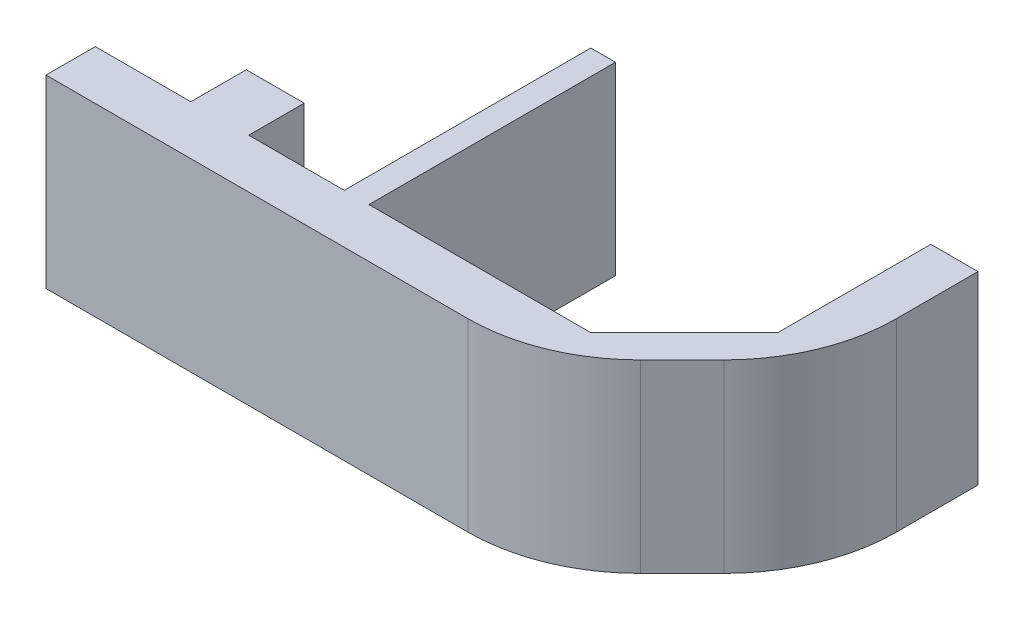
from build123d import *

# Parameters (mm, degrees)
EXTRUDE_1_DEPTH = 15
FILLET_1_R      = 14
SKETCH_2_W      = 2
SKETCH_2_H      = 15
EXTRUDE_2_DEPTH = 20


with BuildPart() as part:
    # 草圖1 → 填料-伸長1 (new body)
    with BuildSketch(Plane(origin=(0, 0, 0), x_dir=(1, 0, 0), z_dir=(0, 1, 0))):
        Polygon((-27.501723192, 6.859259259), (-22.801723192, 6.859259259), (-22.801723192, 2.359259259), (4.948276808, 2.359259259), (12.531610141, 9.942592593), (12.531610141, 22.359259259), (16.361610141, 22.359259259), (16.361610141, 9.942592593), (4.778276808, -1.640740741), (-35.251723192, -1.640740741), (-35.251723192, 2.359259259), (-27.501723192, 2.359259259), align=None)
    extrude(amount=EXTRUDE_1_DEPTH)

    # 圓角1
    fillet_1_edges = [part.edges().sort_by_distance(p)[0] for p in [
        (16.361610141, 7.5, -9.942592593),
        (4.778276808, 7.5, 1.640740741),
    ]]
    fillet(fillet_1_edges, radius=FILLET_1_R)

    # 草圖2 → 填料-伸長2 (add)
    with BuildSketch(Plane(origin=(0, 0, -2.359259259), x_dir=(-1, 0, 0), z_dir=(0, 0, -1))):
        with Locations((14.051723192, 7.5)):
            Rectangle(SKETCH_2_W, SKETCH_2_H)
    extrude(amount=EXTRUDE_2_DEPTH)


solid = part.part
